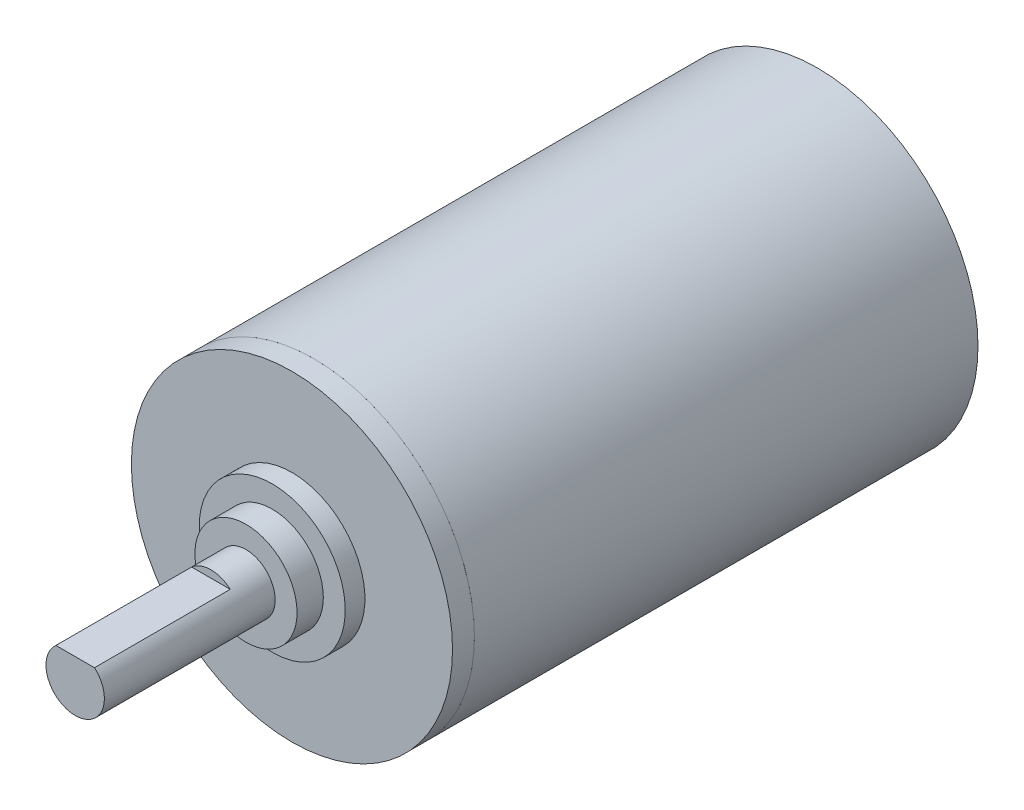
from build123d import *

# Parameters (mm, degrees)
SKETCH1_R                     = 11
BODY_DEPTH                    = 36
SKETCH1_3_R                   = 5
SKETCH1_3_R_2                 = 3.5
COLLAR_1_DEPTH                = 1.35
SKETCH1_4_R                   = 3.5
SKETCH1_4_R_2                 = 2
COLLAR_2_DEPTH                = 3.15
CAP_START                     = -1.5
SKETCH4_R                     = 11
SKETCH4_R_2                   = 10.5
CAP_RING_DEPTH                = 0.001
SKETCH1_5_R                   = 2
SHAFT_DEPTH                   = 14.85
KEY_START                     = -9.3
KEY_WAY_DEPTH                 = 9.3
SKETCH2_R                     = 5
SKETCH2_R_2                   = 1.5
RECESS_FOR_MOTOR_COLLAR_DEPTH = 1
SKETCH2_2_R                   = 1.5
RECESS_FOR_MOTOR_SHAFT_DEPTH  = 10.3


with BuildPart() as part:
    # Sketch1 → Body (new body)
    with BuildSketch(Plane.XY):
        Circle(SKETCH1_R)
    extrude(amount=-BODY_DEPTH)

    # Sketch1<3> → Collar 1 (add)
    with BuildSketch(Plane.XY):
        Circle(SKETCH1_3_R)
        Circle(SKETCH1_3_R_2, mode=Mode.SUBTRACT)
    extrude(amount=COLLAR_1_DEPTH)

    # Sketch1<4> → Collar 2 (add)
    with BuildSketch(Plane.XY):
        Circle(SKETCH1_4_R)
        Circle(SKETCH1_4_R_2, mode=Mode.SUBTRACT)
    extrude(amount=COLLAR_2_DEPTH)

    # Sketch4 → Cap Ring (cut)
    with BuildSketch(Plane.XY.offset(CAP_START)):
        Circle(SKETCH4_R)
        Circle(SKETCH4_R_2, mode=Mode.SUBTRACT)
    extrude(amount=-CAP_RING_DEPTH, mode=Mode.SUBTRACT)

    # Sketch1<5> → Shaft (add)
    with BuildSketch(Plane.XY):
        Circle(SKETCH1_5_R)
    extrude(amount=SHAFT_DEPTH)

    # Sketch3 → Key Way (cut)
    with BuildSketch(Plane.XY.offset(14.85).offset(KEY_START)):
        with BuildLine():
            Line((-1.322875656, 1.5), (0, 1.5))
            Line((0, 1.5), (1.322875656, 1.5))
            ThreePointArc((1.322875656, 1.5), (0, 2), (-1.322875656, 1.5))
        make_face()
    extrude(amount=KEY_WAY_DEPTH, mode=Mode.SUBTRACT)

    # Sketch2 → Recess for Motor Collar (cut)
    with BuildSketch(Plane(origin=(0, 0, -36), x_dir=(-1, 0, 0), z_dir=(0, 0, -1))):
        Circle(SKETCH2_R)
        Circle(SKETCH2_R_2, mode=Mode.SUBTRACT)
    extrude(amount=-RECESS_FOR_MOTOR_COLLAR_DEPTH, mode=Mode.SUBTRACT)

    # Sketch2<2> → Recess for Motor Shaft (cut)
    with BuildSketch(Plane(origin=(0, 0, -36), x_dir=(-1, 0, 0), z_dir=(0, 0, -1))):
        Circle(SKETCH2_2_R)
    extrude(amount=-RECESS_FOR_MOTOR_SHAFT_DEPTH, mode=Mode.SUBTRACT)


solid = part.part
